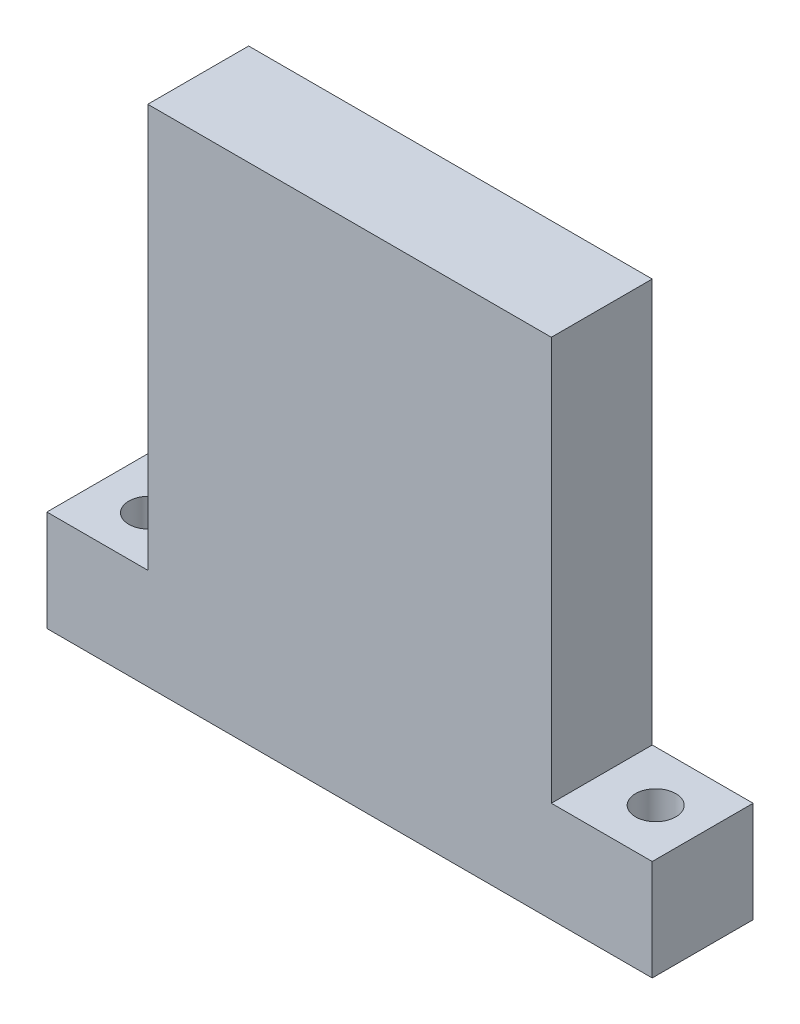
from build123d import *

# Parameters (mm, degrees)
SKETCH1_W           = 60
SKETCH1_H           = 10
BOSS_EXTRUDE1_DEPTH = 10
SKETCH2_W           = 40
SKETCH2_H           = 10
BOSS_EXTRUDE2_DEPTH = 40
SKETCH3_R           = 11
CUT_EXTRUDE1_DEPTH  = 8
SKETCH5_R           = 2
CUT_EXTRUDE2_DEPTH  = 45


with BuildPart() as part:
    # Sketch1 → Boss-Extrude1 (new body)
    with BuildSketch(Plane(origin=(0, 0, 0), x_dir=(1, 0, 0), z_dir=(0, 1, 0))):
        Rectangle(SKETCH1_W, SKETCH1_H)
    extrude(amount=BOSS_EXTRUDE1_DEPTH)

    # Sketch2 → Boss-Extrude2 (add)
    with BuildSketch(Plane(origin=(0, 10, 0), x_dir=(1, 0, 0), z_dir=(0, 1, 0))):
        Rectangle(SKETCH2_W, SKETCH2_H)
    extrude(amount=BOSS_EXTRUDE2_DEPTH)

    # Sketch3 → Cut-Extrude1 (cut)
    with BuildSketch(Plane(origin=(0, 0, -5), x_dir=(-1, 0, 0), z_dir=(0, 0, -1))):
        with Locations((0, 30)):
            Circle(SKETCH3_R)
    extrude(amount=-CUT_EXTRUDE1_DEPTH, mode=Mode.SUBTRACT)

    # Sketch5 → Cut-Extrude2 (cut)
    with BuildSketch(Plane(origin=(0, 10, 0), x_dir=(1, 0, 0), z_dir=(0, 1, 0))):
        with Locations(Location((-24.879663673, 0, 0), (0, 0, 270))):
            Circle(SKETCH5_R)
        with Locations(Location((25.342956813, 0, 0), (0, 0, 270))):
            Circle(SKETCH5_R)
    extrude(amount=-CUT_EXTRUDE2_DEPTH, mode=Mode.SUBTRACT)


solid = part.part
